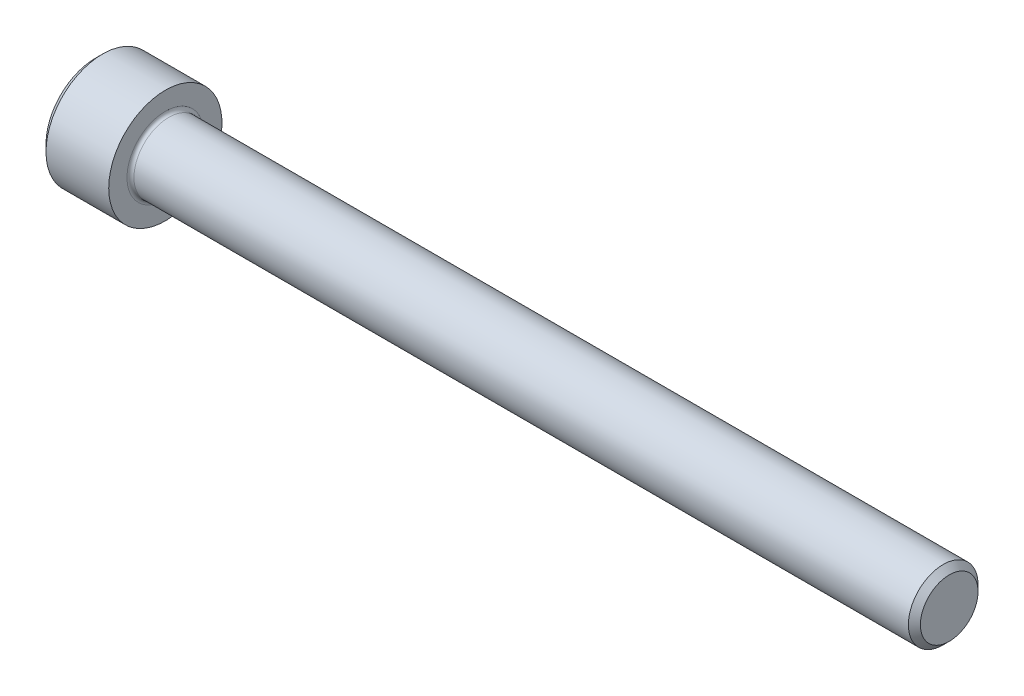
from build123d import *

# Parameters (mm, degrees)
FILLET1_R   = 0.4
HEX_2_DEPTH = 4


with BuildPart() as part:
    # BodySke → Base-Revolve (revolve)
    with BuildSketch(Plane.XY, mode=Mode.PRIVATE) as base_revolve_sk:
        Polygon((0, 0), (0, 5.7), (0.8, 6.5), (8, 6.5), (8, 4), (97.3095, 4), (98, 3.3095), (98, 0), align=None)
    revolve(base_revolve_sk.sketch.rotate(Axis((-31.75, 0, 0), (1, 0, 0)), 90), axis=Axis((-31.75, 0, 0), (1, 0, 0)))

    # Fillet1
    fillet1_edges = [part.edges().sort_by_distance(p)[0] for p in [
        (8, 0, -4),
    ]]
    fillet(fillet1_edges, radius=FILLET1_R)

    # Sketch2 → Hex-PreBroach (revolve, cut)
    with BuildSketch(Plane.XY, mode=Mode.PRIVATE) as hex_prebroach_sk:
        Polygon((0, 3.0475), (4, 3.0475), (5.759474945, 0), (0, 0), align=None)
    revolve(hex_prebroach_sk.sketch.rotate(Axis((0, 0, 0), (1, 0, 0)), 90), axis=Axis((0, 0, 0), (1, 0, 0)), mode=Mode.SUBTRACT)

    # Sketch3 → Hex 2 (cut)
    with BuildSketch(Plane(origin=(0, 0, 0), x_dir=(0, 0.500000000000001, 0.866025403784438), z_dir=(-1, 0, 0))):
        Polygon((1.759474945, 3.0475), (-1.759474945, 3.0475), (-3.518949891, 0), (-1.759474945, -3.0475), (1.759474945, -3.0475), (3.518949891, 0), align=None)
    extrude(amount=-HEX_2_DEPTH, mode=Mode.SUBTRACT)


solid = part.part
